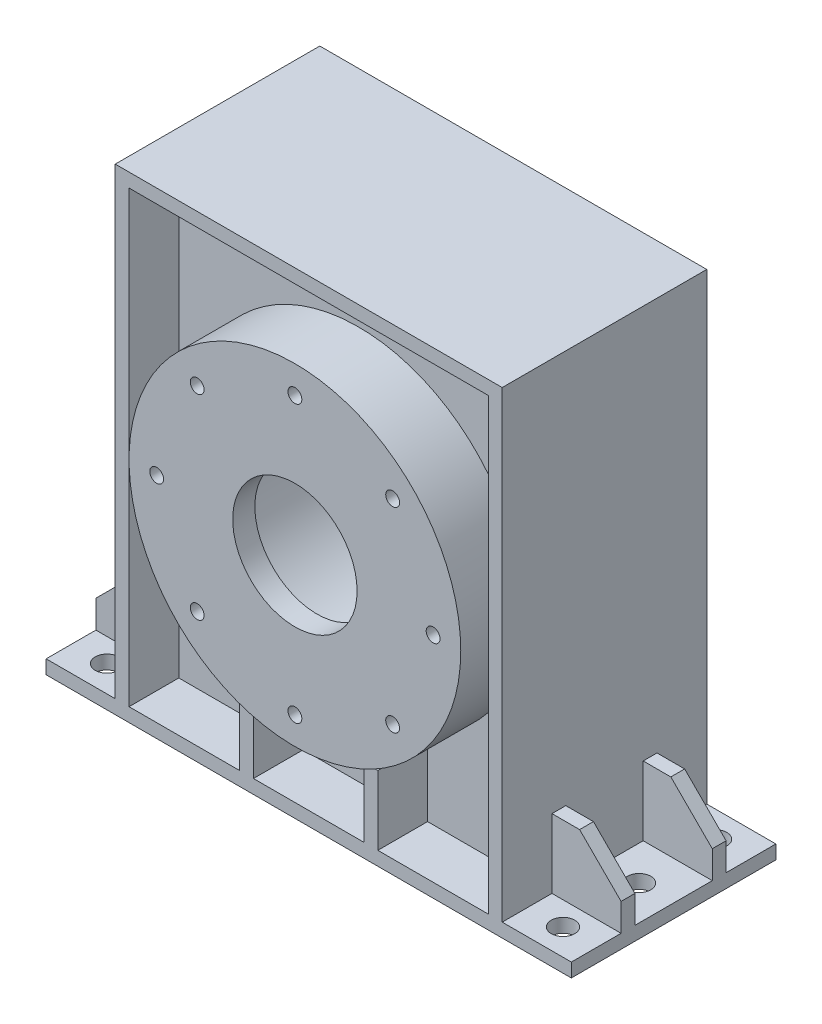
from build123d import *

# Parameters (mm, degrees)
SKETCH_1_W               = 380
SKETCH_1_H               = 148
EXTRUDE_1_DEPTH          = 10
SKETCH_2_W               = 260
SKETCH_2_H               = 56
EXTRUDE_2_DEPTH          = 325
SKETCH_3_W               = 280
SKETCH_3_H               = 148
EXTRUDE_3_DEPTH          = 10
SKETCH_4_R               = 120
CUT_EXTRUDE_1_DEPTH      = 526.327516888
SKETCH_5_R               = 120
SKETCH_5_R_2             = 80
EXTRUDE_4_DEPTH          = 148
SKETCH_6_W               = 10
SKETCH_6_H               = 36
EXTRUDE_5_DEPTH          = 50
SKETCH_7_W               = 50
SKETCH_7_H               = 10
EXTRUDE_6_DEPTH          = 50
CUT_EXTRUDE_2_DEPTH      = 526.327516888
SKETCH_9_R               = 80
SKETCH_9_R_2             = 65
EXTRUDE_7_DEPTH          = 14
SKETCH_10_R              = 65
SKETCH_10_R_2            = 45
EXTRUDE_8_DEPTH          = 6
EXTRUDE_START            = 10
SKETCH_11_R              = 120
SKETCH_11_R_2            = 45
EXTRUDE_9_DEPTH          = 10
EXTRUDE_START_2          = -14
SKETCH_12_R              = 80
SKETCH_12_R_2            = 65
EXTRUDE_10_DEPTH         = 14
EXTRUDE_START_3          = -5
SKETCH_13_R              = 65
EXTRUDE_11_DEPTH         = 5
SKETCH_14_R              = 120
EXTRUDE_12_DEPTH         = 10
SKETCH_15_R              = 8.5
CUT_EXTRUDE_3_DEPTH      = 10
SKETCH_16_R              = 5
CUT_EXTRUDE_4_DEPTH      = 25
CUT_EXTRUDE_START        = -25
SKETCH_17_R              = 5
CUT_EXTRUDE_5_DEPTH      = 25
PATTERN_CIRCULAR_1_COUNT = 8


with BuildPart() as part:
    # 草图1 → 凸台-拉伸1 (new body)
    with BuildSketch(Plane(origin=(0, 0, 0), x_dir=(1, 0, 0), z_dir=(0, 1, 0))):
        with Locations((190, 74)):
            Rectangle(SKETCH_1_W, SKETCH_1_H)
    extrude(amount=EXTRUDE_1_DEPTH)

    # 草图2 → 凸台-拉伸2 (add)
    with BuildSketch(Plane(origin=(0, 10, 0), x_dir=(1, 0, 0), z_dir=(0, 1, 0))):
        Polygon((50, 148), (60, 148), (60, 112), (320, 112), (320, 148), (330, 148), (330, 0), (320, 0), (320, 36), (60, 36), (60, 0), (50, 0), align=None)
        with Locations((190, 74)):
            Rectangle(SKETCH_2_W, SKETCH_2_H, mode=Mode.SUBTRACT)
    extrude(amount=EXTRUDE_2_DEPTH)

    # 草图3 → 凸台-拉伸3 (add)
    with BuildSketch(Plane(origin=(0, 335, 0), x_dir=(1, 0, 0), z_dir=(0, 1, 0))):
        with Locations((190, 74)):
            Rectangle(SKETCH_3_W, SKETCH_3_H)
    extrude(amount=EXTRUDE_3_DEPTH)

    # 草图4 → 切除-拉伸1 (cut, through all)
    with BuildSketch(Plane.XY.offset(-36)):
        with Locations((190, 175)):
            Circle(SKETCH_4_R)
    extrude(amount=-CUT_EXTRUDE_1_DEPTH, mode=Mode.SUBTRACT)

    # 草图5 → 凸台-拉伸4 (add)
    with BuildSketch(Plane.XY):
        with Locations((190, 175)):
            Circle(SKETCH_5_R)
        with Locations((190, 175)):
            Circle(SKETCH_5_R_2, mode=Mode.SUBTRACT)
    extrude(amount=-EXTRUDE_4_DEPTH)

    # 草图6 → 凸台-拉伸5 (add)
    with BuildSketch(Plane(origin=(0, 10, 0), x_dir=(1, 0, 0), z_dir=(0, 1, 0))):
        with Locations((145, 18)):
            Rectangle(SKETCH_6_W, SKETCH_6_H)
        with Locations((235, 18)):
            Rectangle(SKETCH_6_W, SKETCH_6_H)
        with Locations((235, 130)):
            Rectangle(SKETCH_6_W, SKETCH_6_H)
        with Locations((145, 130)):
            Rectangle(SKETCH_6_W, SKETCH_6_H)
    extrude(amount=EXTRUDE_5_DEPTH)

    # 草图7 → 凸台-拉伸6 (add)
    with BuildSketch(Plane(origin=(0, 10, 0), x_dir=(1, 0, 0), z_dir=(0, 1, 0))):
        with Locations((355, 41)):
            Rectangle(SKETCH_7_W, SKETCH_7_H)
        with Locations((355, 107)):
            Rectangle(SKETCH_7_W, SKETCH_7_H)
        with Locations((25, 107)):
            Rectangle(SKETCH_7_W, SKETCH_7_H)
        with Locations((25, 41)):
            Rectangle(SKETCH_7_W, SKETCH_7_H)
    extrude(amount=EXTRUDE_6_DEPTH)

    # 草图8 → 切除-拉伸2 (cut, through all)
    with BuildSketch(Plane(origin=(0, 0, -112), x_dir=(-1, 0, 0), z_dir=(0, 0, -1))):
        Polygon((-380, 60), (-350, 60), (-380, 30), align=None)
        Polygon((0, 60), (-30, 60), (0, 30), align=None)
    extrude(amount=-CUT_EXTRUDE_2_DEPTH, mode=Mode.SUBTRACT)



with BuildPart() as body_2:
    # 草图9 → 凸台-拉伸7 (new body)
    with BuildSketch(Plane.XY):
        with Locations((190, 175)):
            Circle(SKETCH_9_R)
        with Locations((190, 175)):
            Circle(SKETCH_9_R_2, mode=Mode.SUBTRACT)
    extrude(amount=-EXTRUDE_7_DEPTH)


with BuildPart() as part_1:
    add(part.part)

    add(body_2.part)  # 凸台-拉伸8 merges body 2
    # 草图10 → 凸台-拉伸8 (add)
    with BuildSketch(Plane.XY):
        with Locations((190, 175)):
            Circle(SKETCH_10_R)
        with Locations((190, 175)):
            Circle(SKETCH_10_R_2, mode=Mode.SUBTRACT)
    extrude(amount=-EXTRUDE_8_DEPTH)

    # 草图11 → 凸台-拉伸9 (add)
    with BuildSketch(Plane.XY.offset(EXTRUDE_START)):
        with Locations((190, 175)):
            Circle(SKETCH_11_R)
        with Locations((190, 175)):
            Circle(SKETCH_11_R_2, mode=Mode.SUBTRACT)
    extrude(amount=-EXTRUDE_9_DEPTH)

    # 草图12 → 凸台-拉伸10 (add)
    with BuildSketch(Plane(origin=(0, 0, -148), x_dir=(-1, 0, 0), z_dir=(0, 0, -1)).offset(EXTRUDE_START_2)):
        with Locations(Location((-190, 175, 0), (0, 0, 180))):
            Circle(SKETCH_12_R)
        with Locations(Location((-190, 175, 0), (0, 0, 180))):
            Circle(SKETCH_12_R_2, mode=Mode.SUBTRACT)
    extrude(amount=EXTRUDE_10_DEPTH)

    # 草图13 → 凸台-拉伸11 (add)
    with BuildSketch(Plane(origin=(0, 0, -148), x_dir=(-1, 0, 0), z_dir=(0, 0, -1)).offset(EXTRUDE_START_3)):
        with Locations((-190, 175)):
            Circle(SKETCH_13_R)
    extrude(amount=EXTRUDE_11_DEPTH)

    # 草图14 → 凸台-拉伸12 (add)
    with BuildSketch(Plane(origin=(0, 0, -148), x_dir=(-1, 0, 0), z_dir=(0, 0, -1))):
        with Locations(Location((-190, 175, 0), (0, 0, 180))):
            Circle(SKETCH_14_R)
    extrude(amount=EXTRUDE_12_DEPTH)

    # 草图15 → 切除-拉伸3 (cut)
    with BuildSketch(Plane.XZ):
        with Locations(Location((25, -129, 0), (0, 0, 270))):
            Circle(SKETCH_15_R)
        with Locations(Location((25, -74, 0), (0, 0, 270))):
            Circle(SKETCH_15_R)
        with Locations(Location((25, -19, 0), (0, 0, 270))):
            Circle(SKETCH_15_R)
        with Locations(Location((190, -129, 0), (0, 0, 270))):
            Circle(SKETCH_15_R)
        with Locations(Location((100, -129, 0), (0, 0, 270))):
            Circle(SKETCH_15_R)
        with Locations(Location((280, -129, 0), (0, 0, 270))):
            Circle(SKETCH_15_R)
        with Locations(Location((355, -74, 0), (0, 0, 270))):
            Circle(SKETCH_15_R)
        with Locations(Location((355, -129, 0), (0, 0, 270))):
            Circle(SKETCH_15_R)
        with Locations(Location((355, -19, 0), (0, 0, 270))):
            Circle(SKETCH_15_R)
    extrude(amount=-CUT_EXTRUDE_3_DEPTH, mode=Mode.SUBTRACT)

    # 草图16 → 切除-拉伸4 (cut)
    with BuildSketch(Plane.XY.offset(10)):
        with Locations((190, 275)):
            Circle(SKETCH_16_R)
    cut_extrude_4 = extrude(amount=-CUT_EXTRUDE_4_DEPTH, mode=Mode.SUBTRACT)

    # 草图17 → 切除-拉伸5 (cut)
    with BuildSketch(Plane(origin=(0, 0, -158), x_dir=(-1, 0, 0), z_dir=(0, 0, -1)).offset(CUT_EXTRUDE_START)):
        with Locations(Location((-190, 275, 0), (0, 0, 180))):
            Circle(SKETCH_17_R)
    cut_extrude_5 = extrude(amount=CUT_EXTRUDE_5_DEPTH, mode=Mode.SUBTRACT)

    # 阵列(圆周)1: 切除-拉伸4, 切除-拉伸5 ×8 about axis
    pattern_circular_1_axis = Axis((190, 175, 0), (0, 0, 1))
    add([cut_extrude_4.rotate(pattern_circular_1_axis, i * 360 / PATTERN_CIRCULAR_1_COUNT) for i in range(1, PATTERN_CIRCULAR_1_COUNT)], mode=Mode.SUBTRACT)
    add([cut_extrude_5.rotate(pattern_circular_1_axis, i * 360 / PATTERN_CIRCULAR_1_COUNT) for i in range(1, PATTERN_CIRCULAR_1_COUNT)], mode=Mode.SUBTRACT)


solid = part_1.part
